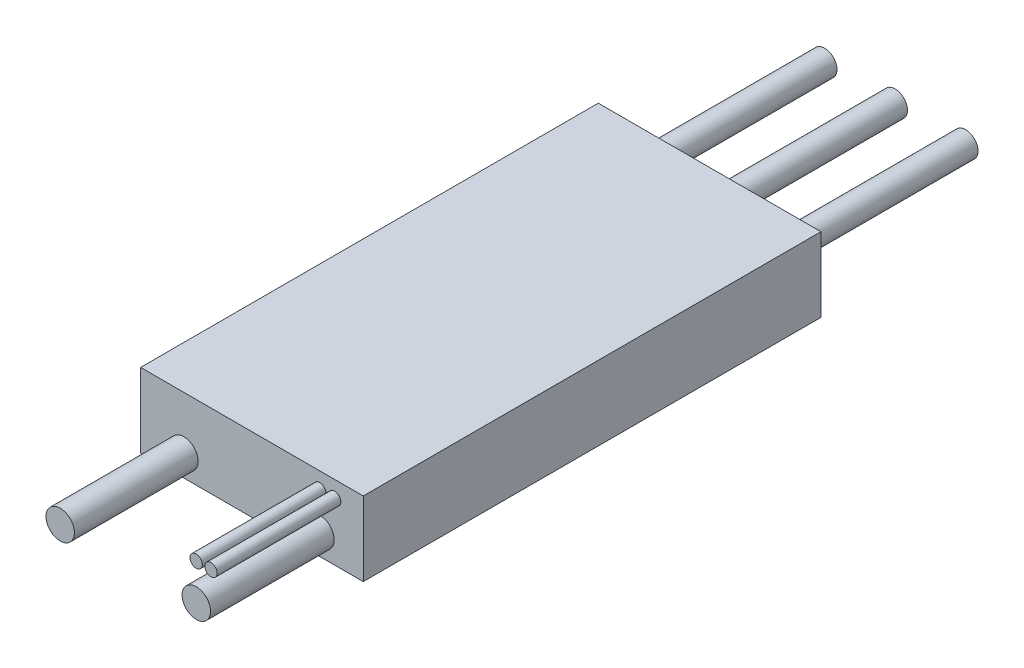
from build123d import *

# Parameters (mm, degrees)
ESQUISSE1_W          = 18
ESQUISSE1_H          = 37
BOSS_EXTRU_1_DEPTH   = 6
ESQUISSE2_R          = 1.15
BOSS_EXTRU_2_DEPTH   = 10
BOSS_EXTRU_2_2_DEPTH = 10
ESQUISSE2_R_2        = 0.5
BOSS_EXTRU_2_3_DEPTH = 10
BOSS_EXTRU_2_4_DEPTH = 10
ESQUISSE3_R          = 1
BOSS_EXTRU_3_DEPTH   = 15
BOSS_EXTRU_3_2_DEPTH = 15
BOSS_EXTRU_3_3_DEPTH = 15


with BuildPart() as part:
    # Esquisse1 → Boss.-Extru.1 (new body)
    with BuildSketch(Plane(origin=(0, 0, 0), x_dir=(1, 0, 0), z_dir=(0, 1, 0))):
        Rectangle(ESQUISSE1_W, ESQUISSE1_H)
    extrude(amount=BOSS_EXTRU_1_DEPTH)


with BuildPart() as body_2:
    # Esquisse2 → Boss.-Extru.2 (new body)
    with BuildSketch(Plane.XY.offset(18.5)):
        with Locations((-5.5, 1.745362632)):
            Circle(ESQUISSE2_R)
    extrude(amount=BOSS_EXTRU_2_DEPTH)


with BuildPart() as body_3:
    # Esquisse2 → Boss.-Extru.2 2 (new body)
    with BuildSketch(Plane.XY.offset(18.5)):
        with Locations(Location((5.5, 1.745362632, 0), (0, 0, 180))):
            Circle(ESQUISSE2_R)
    extrude(amount=BOSS_EXTRU_2_2_DEPTH)


with BuildPart() as body_4:
    # Esquisse2 → Boss.-Extru.2 3 (new body)
    with BuildSketch(Plane.XY.offset(18.5)):
        with Locations((6.688031395, 4.681212966)):
            Circle(ESQUISSE2_R_2)
    extrude(amount=BOSS_EXTRU_2_3_DEPTH)


with BuildPart() as body_5:
    # Esquisse2 → Boss.-Extru.2 4 (new body)
    with BuildSketch(Plane.XY.offset(18.5)):
        with Locations((5.488031395, 4.681212966)):
            Circle(ESQUISSE2_R_2)
    extrude(amount=BOSS_EXTRU_2_4_DEPTH)


with BuildPart() as body_6:
    # Esquisse3 → Boss.-Extru.3 (new body)
    with BuildSketch(Plane(origin=(0, 0, -18.5), x_dir=(-1, 0, 0), z_dir=(0, 0, -1))):
        with Locations((-5.7, 3)):
            Circle(ESQUISSE3_R)
    extrude(amount=BOSS_EXTRU_3_DEPTH)


with BuildPart() as body_7:
    # Esquisse3 → Boss.-Extru.3 2 (new body)
    with BuildSketch(Plane(origin=(0, 0, -18.5), x_dir=(-1, 0, 0), z_dir=(0, 0, -1))):
        with Locations((0, 3)):
            Circle(ESQUISSE3_R)
    extrude(amount=BOSS_EXTRU_3_2_DEPTH)


with BuildPart() as body_8:
    # Esquisse3 → Boss.-Extru.3 3 (new body)
    with BuildSketch(Plane(origin=(0, 0, -18.5), x_dir=(-1, 0, 0), z_dir=(0, 0, -1))):
        with Locations(Location((5.7, 3, 0), (0, 0, 180))):
            Circle(ESQUISSE3_R)
    extrude(amount=BOSS_EXTRU_3_3_DEPTH)


solid = Compound([part.part, body_2.part, body_3.part, body_4.part, body_5.part, body_6.part, body_7.part, body_8.part])
